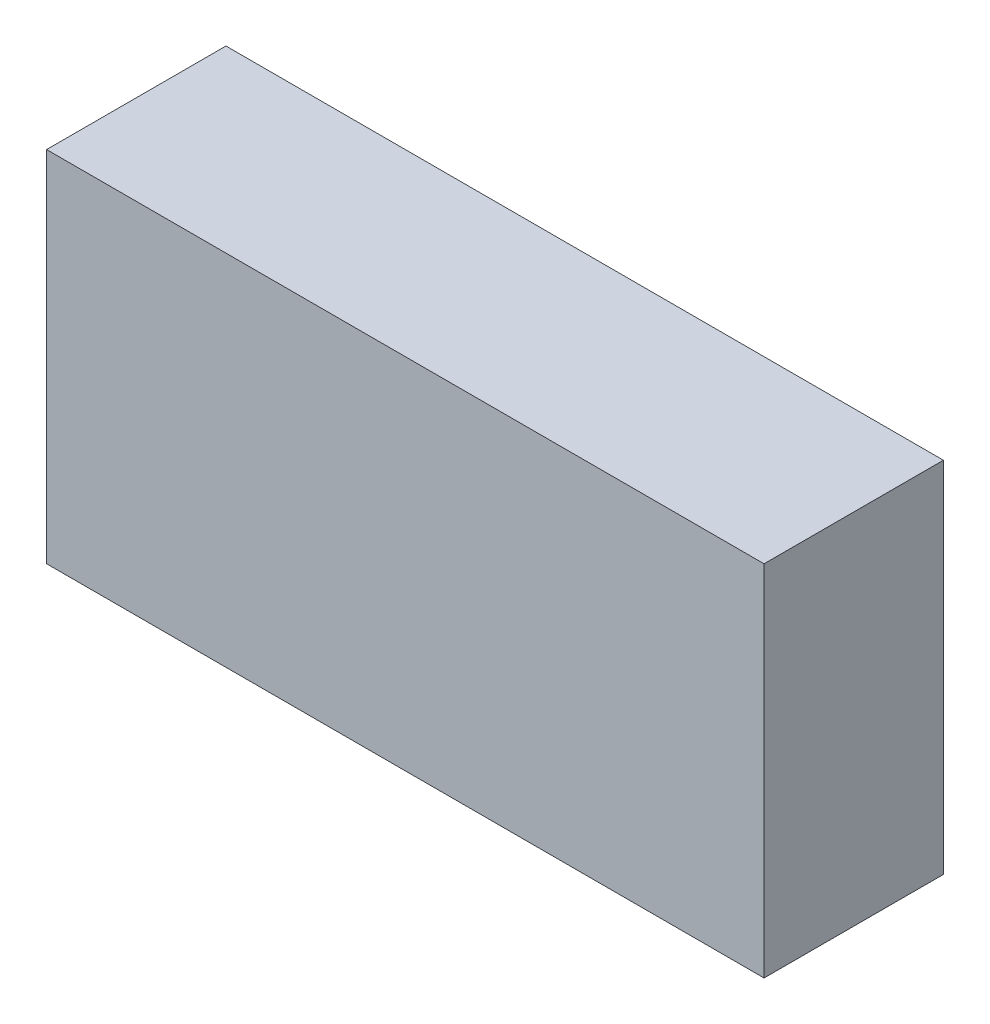
from build123d import *

# Parameters (mm, degrees)
RECTANGLESKETCH_W = 40
RECTANGLESKETCH_H = 20
BLINDBOSS_DEPTH   = 10


with BuildPart() as part:
    # RectangleSketch → BlindBoss (new body)
    with BuildSketch(Plane.XY):
        with Locations((20, 10)):
            Rectangle(RECTANGLESKETCH_W, RECTANGLESKETCH_H)
    extrude(amount=-BLINDBOSS_DEPTH)


solid = part.part
